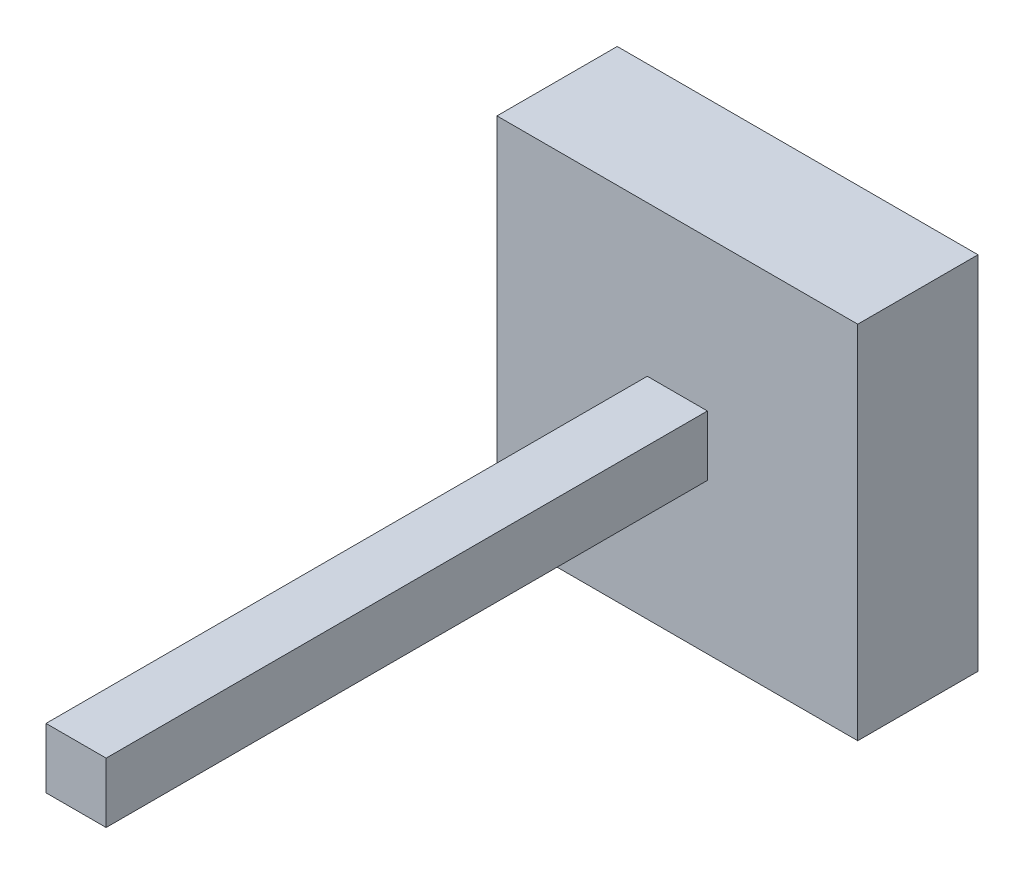
from build123d import *

# Parameters (mm, degrees)
SKETCH_1_W      = 10
SKETCH_1_H      = 10
EXTRUDE_1_DEPTH = 100
SKETCH_2_W      = 60
SKETCH_2_H      = 60
EXTRUDE_2_DEPTH = 20


with BuildPart() as part:
    # 草图1 → 凸台-拉伸1 (new body)
    with BuildSketch(Plane.XY):
        with Locations((5, 5)):
            Rectangle(SKETCH_1_W, SKETCH_1_H)
    extrude(amount=EXTRUDE_1_DEPTH)

    # 草图2 → 凸台-拉伸2 (add)
    with BuildSketch(Plane(origin=(0, 0, 0), x_dir=(-1, 0, 0), z_dir=(0, 0, -1))):
        with Locations((-5, 5)):
            Rectangle(SKETCH_2_W, SKETCH_2_H)
    extrude(amount=EXTRUDE_2_DEPTH)


solid = part.part
